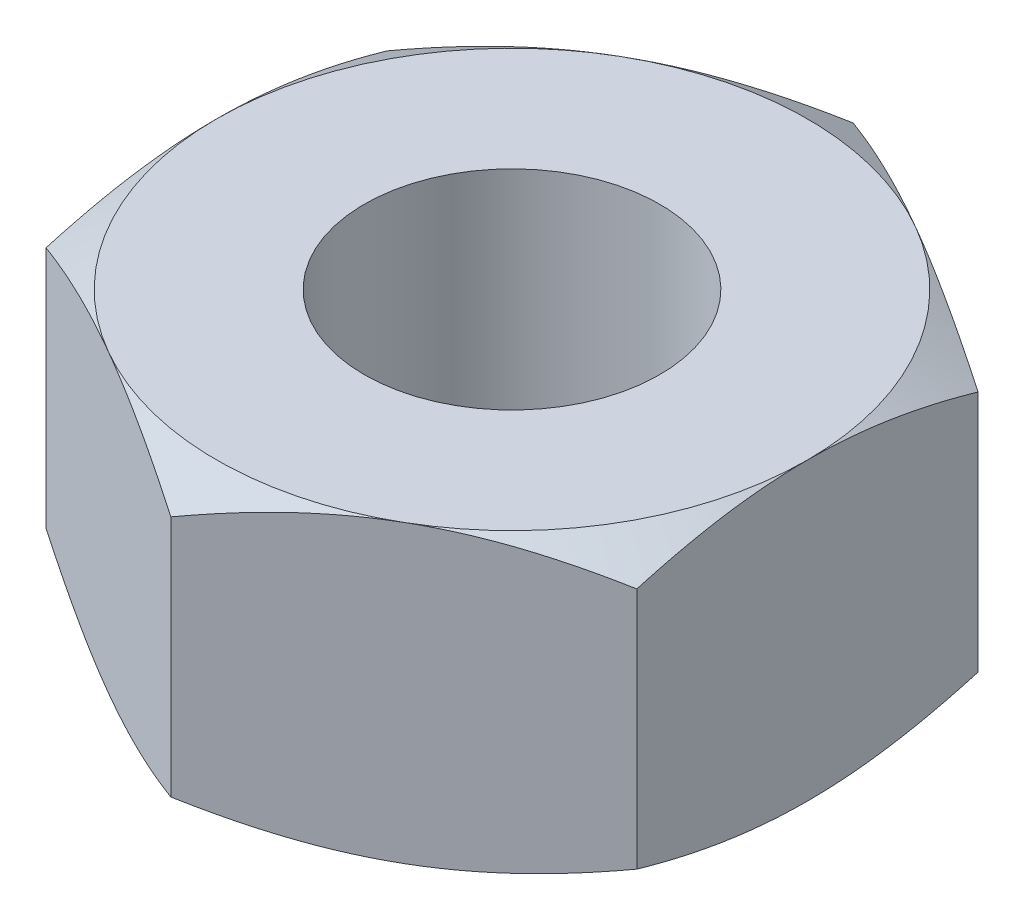
from build123d import *

# Parameters (mm, degrees)
SKETCH1_R               = 1
BOSS_EXTRUDE1_DEPTH     = 1
SKETCH5_OUTSIDE_W       = 23.4
SKETCH5_OUTSIDE_H       = 24.018
SKETCH5_OUTSIDE_R       = 2
CUT_EXTRUDE2_DEPTH      = 4.651483717
CUT_EXTRUDE2_DRAFT      = -60
MIRROR1_COPY_1_SKETCH_W = 23.4
MIRROR1_COPY_1_SKETCH_H = 24.018
MIRROR1_COPY_1_SKETCH_R = 2
MIRROR1_COPY_1_DEPTH    = 4.651483717
MIRROR1_COPY_1_DRAFT    = -60


with BuildPart() as part:
    # Sketch1 → Boss-Extrude1 (new, symmetric)
    with BuildSketch(Plane(origin=(0, 0, 0), x_dir=(1, 0, 0), z_dir=(0, 1, 0))):
        Polygon((-2, 1.154700538), (-2, -1.154700538), (0, -2.309401077), (2, -1.154700538), (2, 1.154700538), (0, 2.309401077), align=None)
        Circle(SKETCH1_R, mode=Mode.SUBTRACT)
    extrude(amount=BOSS_EXTRUDE1_DEPTH, both=True)


with BuildPart() as cut_extrude2_tool:
    # Sketch5 outside → Cut-Extrude2 (with draft: the straight prism first)
    with BuildSketch(Plane(origin=(0, 1, 0), x_dir=(1, 0, 0), z_dir=(0, 1, 0))):
        Rectangle(SKETCH5_OUTSIDE_W, SKETCH5_OUTSIDE_H)
        Circle(SKETCH5_OUTSIDE_R, mode=Mode.SUBTRACT)
    extrude(amount=-CUT_EXTRUDE2_DEPTH)
    # Cut-Extrude2: the draft: its side faces are tilted about the plane it starts from
    cut_extrude2_sides = [cut_extrude2_tool.faces().sort_by_distance(p)[0] for p in [
        (0, -1.325741858, 12.009),
        (11.7, -1.325741858, 0),
        (0, -1.325741858, -12.009),
        (-11.7, -1.325741858, 0),
        (-2, -1.325741858, 0),
    ]]
    draft(cut_extrude2_sides, Plane(origin=(0, 1, 0), x_dir=(1, 0, 0), z_dir=(0, 1, 0)), CUT_EXTRUDE2_DRAFT)


with BuildPart() as part_1:
    add(part.part)

    # Cut-Extrude2: cut by cut_extrude2_tool
    add(cut_extrude2_tool.part, mode=Mode.SUBTRACT)


with BuildPart() as mirror1_copy_1_tool:
    # Mirror1 copy 1 sketch → Mirror1 copy 1 (with draft: the straight prism first)
    with BuildSketch(Plane.XZ.offset(1)):
        Rectangle(MIRROR1_COPY_1_SKETCH_W, MIRROR1_COPY_1_SKETCH_H)
        Circle(MIRROR1_COPY_1_SKETCH_R, mode=Mode.SUBTRACT)
    extrude(amount=-MIRROR1_COPY_1_DEPTH)
    # Mirror1 copy 1: the draft: its side faces are tilted about the plane it starts from
    mirror1_copy_1_sides = [mirror1_copy_1_tool.faces().sort_by_distance(p)[0] for p in [
        (0, 1.325741858, 12.009),
        (11.7, 1.325741858, 0),
        (0, 1.325741858, -12.009),
        (-11.7, 1.325741858, 0),
        (-2, 1.325741858, 0),
    ]]
    draft(mirror1_copy_1_sides, Plane.XZ.offset(1), MIRROR1_COPY_1_DRAFT)


with BuildPart() as part_2:
    add(part_1.part)

    # Mirror1 copy 1: cut by mirror1_copy_1_tool
    add(mirror1_copy_1_tool.part, mode=Mode.SUBTRACT)


solid = part_2.part
